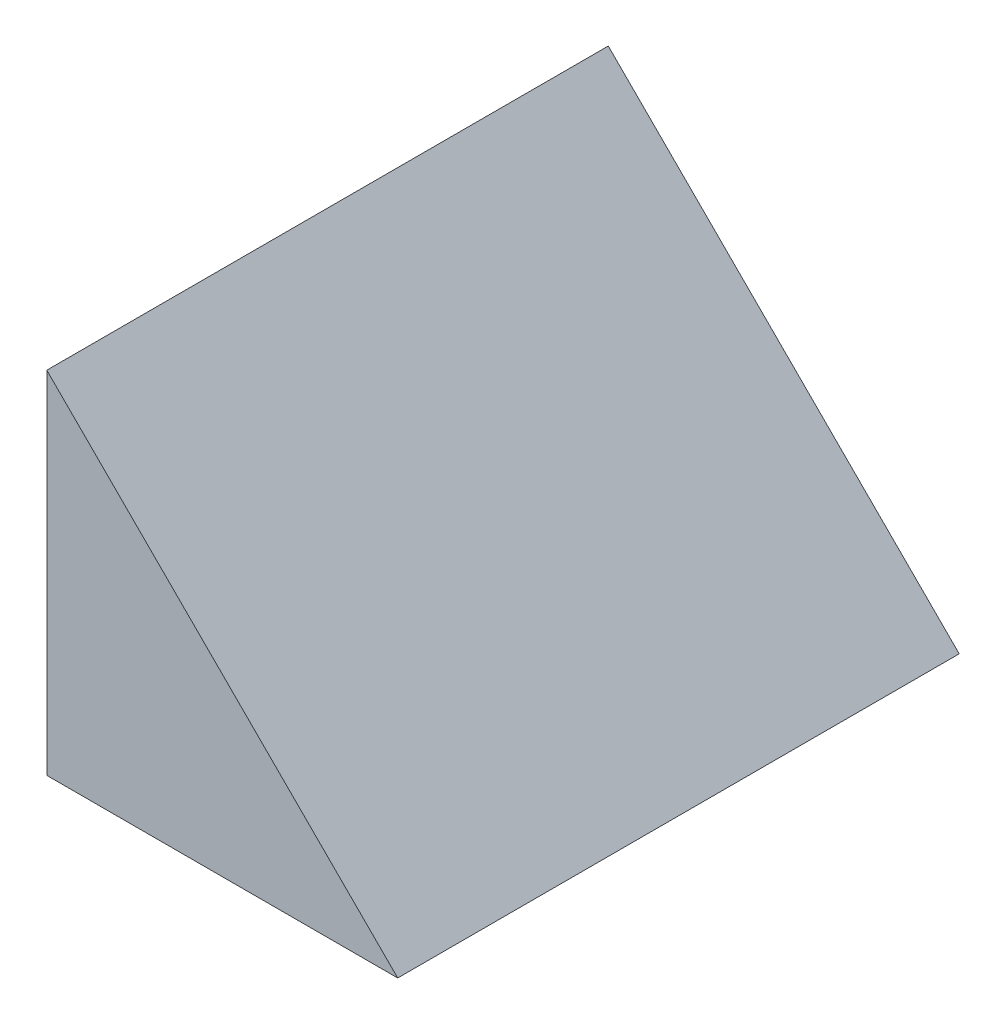
from build123d import *

# Parameters (mm, degrees)
BOSS_EXTRUDE1_DEPTH = 0.4


with BuildPart() as part:
    # Sketch1 → Boss-Extrude1 (new body)
    with BuildSketch(Plane.XY):
        Polygon((0, 0), (0, 0.25), (0.25, 0), align=None)
    extrude(amount=BOSS_EXTRUDE1_DEPTH)


solid = part.part
